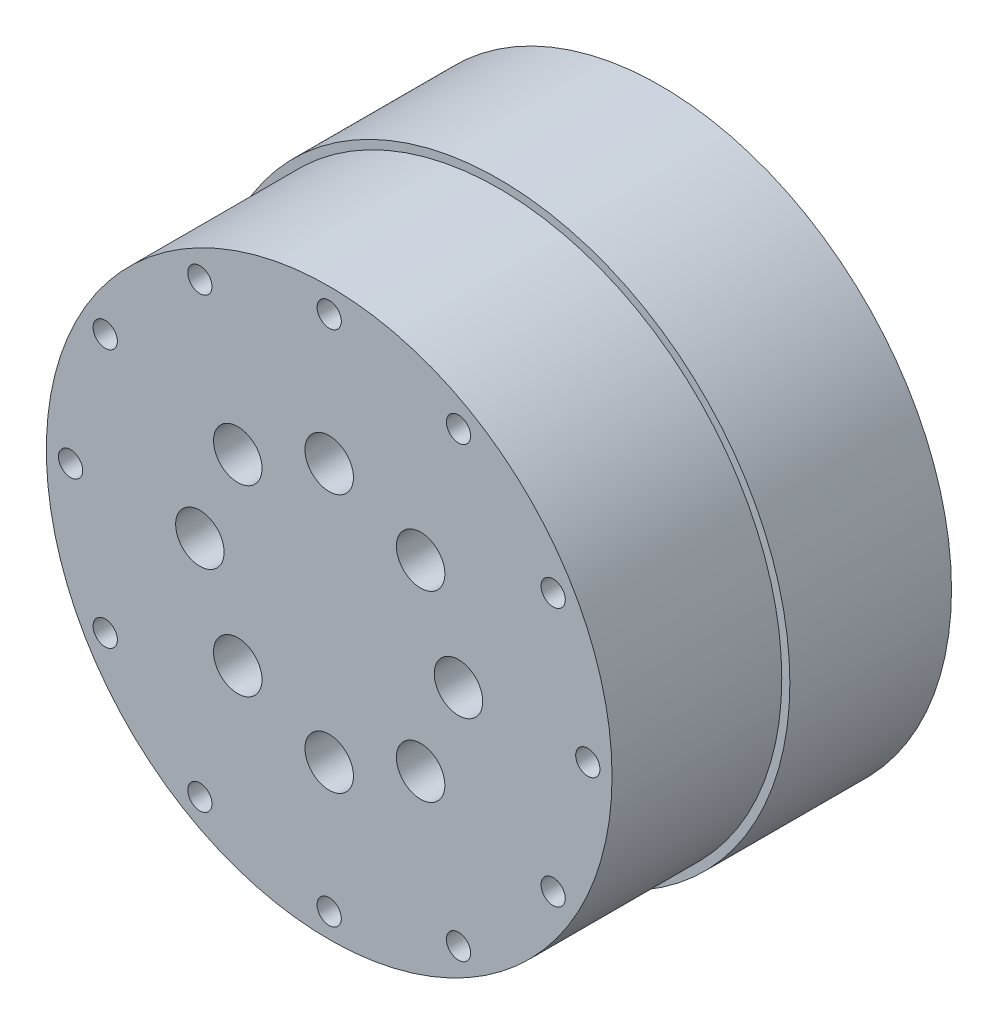
from build123d import *

# Parameters (mm, degrees)
SKETCH_1_R          = 36
SKETCH_1_R_2        = 1.5
EXTRUDE_1_DEPTH     = 41
SKETCH_2_R          = 3
CUT_EXTRUDE_1_DEPTH = 12
SKETCH_3_R          = 4
CUT_EXTRUDE_2_DEPTH = 12
SKETCH_4_R          = 1.25
CUT_EXTRUDE_3_DEPTH = 12
CUT_EXTRUDE_START   = -21
SKETCH_5_R          = 36
SKETCH_5_R_2        = 35
CUT_EXTRUDE_4_DEPTH = 21


with BuildPart() as part:
    # 草图1 → 凸台-拉伸1 (new body)
    with BuildSketch(Plane.XY):
        Circle(SKETCH_1_R)
        with Locations((32, 0)):
            Circle(SKETCH_1_R_2, mode=Mode.SUBTRACT)
        with Locations((27.712812921, -16)):
            Circle(SKETCH_1_R_2, mode=Mode.SUBTRACT)
        with Locations((16, -27.712812921)):
            Circle(SKETCH_1_R_2, mode=Mode.SUBTRACT)
        with Locations((0, -32)):
            Circle(SKETCH_1_R_2, mode=Mode.SUBTRACT)
        with Locations((-16, -27.712812921)):
            Circle(SKETCH_1_R_2, mode=Mode.SUBTRACT)
        with Locations((-27.712812921, -16)):
            Circle(SKETCH_1_R_2, mode=Mode.SUBTRACT)
        with Locations((-32, 0)):
            Circle(SKETCH_1_R_2, mode=Mode.SUBTRACT)
        with Locations((-27.712812921, 16)):
            Circle(SKETCH_1_R_2, mode=Mode.SUBTRACT)
        with Locations((-16, 27.712812921)):
            Circle(SKETCH_1_R_2, mode=Mode.SUBTRACT)
        with Locations((0, 32)):
            Circle(SKETCH_1_R_2, mode=Mode.SUBTRACT)
        with Locations((16, 27.712812921)):
            Circle(SKETCH_1_R_2, mode=Mode.SUBTRACT)
        with Locations((27.712812921, 16)):
            Circle(SKETCH_1_R_2, mode=Mode.SUBTRACT)
    extrude(amount=EXTRUDE_1_DEPTH)

    # 草图2 → 切除-拉伸1 (cut)
    with BuildSketch(Plane.XY.offset(41)):
        with Locations((16, 0)):
            Circle(SKETCH_2_R)
        with Locations((11.313708499, -11.313708499)):
            Circle(SKETCH_2_R)
        with Locations((0, -16)):
            Circle(SKETCH_2_R)
        with Locations((-11.313708499, -11.313708499)):
            Circle(SKETCH_2_R)
        with Locations((-16, 0)):
            Circle(SKETCH_2_R)
        with Locations((-11.313708499, 11.313708499)):
            Circle(SKETCH_2_R)
        with Locations((0, 16)):
            Circle(SKETCH_2_R)
        with Locations((11.313708499, 11.313708499)):
            Circle(SKETCH_2_R)
    extrude(amount=-CUT_EXTRUDE_1_DEPTH, mode=Mode.SUBTRACT)

    # 草图3 → 切除-拉伸2 (cut)
    with BuildSketch(Plane(origin=(0, 0, 0), x_dir=(-1, 0, 0), z_dir=(0, 0, -1))):
        Circle(SKETCH_3_R)
    extrude(amount=-CUT_EXTRUDE_2_DEPTH, mode=Mode.SUBTRACT)

    # 草图4 → 切除-拉伸3 (cut)
    with BuildSketch(Plane(origin=(0, 0, 0), x_dir=(-1, 0, 0), z_dir=(0, 0, -1))):
        with Locations((7, 0)):
            Circle(SKETCH_4_R)
        with Locations((0, -7)):
            Circle(SKETCH_4_R)
        with Locations((-7, 0)):
            Circle(SKETCH_4_R)
        with Locations((0, 7)):
            Circle(SKETCH_4_R)
    extrude(amount=-CUT_EXTRUDE_3_DEPTH, mode=Mode.SUBTRACT)

    # 草图5 → 切除-拉伸4 (cut)
    with BuildSketch(Plane.XY.offset(41).offset(CUT_EXTRUDE_START)):
        Circle(SKETCH_5_R)
        Circle(SKETCH_5_R_2, mode=Mode.SUBTRACT)
    extrude(amount=CUT_EXTRUDE_4_DEPTH, mode=Mode.SUBTRACT)


solid = part.part
